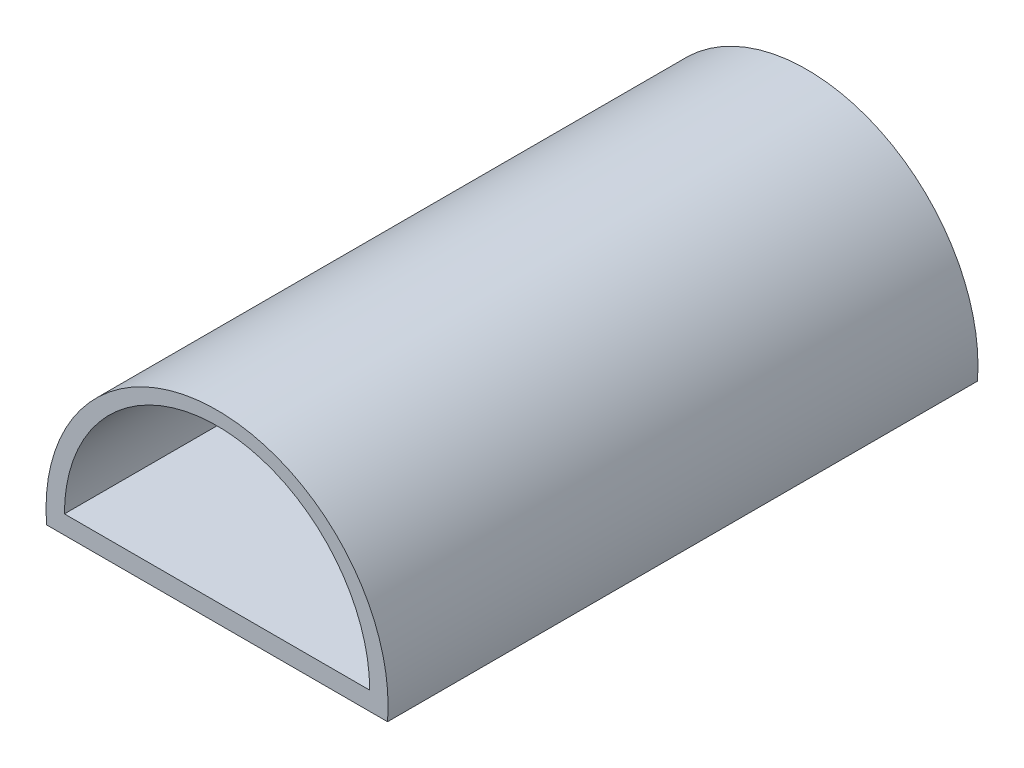
from build123d import *

# Parameters (mm, degrees)
BOSS_EXTRUDE2_DEPTH = 50.8


with BuildPart() as part:
    # Sketch1 → Boss-Extrude2 (new body)
    with BuildSketch(Plane.XY):
        with BuildLine():
            Line((-23.111377793, -10.048425127), (6.257372207, -10.048425127))
            ThreePointArc((6.257372207, -10.048425127), (-8.427002793, 5.85418124), (-23.111377793, -10.048425127))
        make_face()
        with BuildLine():
            Line((-8.427002793, -8.460925127), (-21.571502793, -8.460925127))
            ThreePointArc((-21.571502793, -8.460925127), (-8.427002793, 4.683574873), (4.717497207, -8.460925127))
            Line((4.717497207, -8.460925127), (-8.427002793, -8.460925127))
        make_face(mode=Mode.SUBTRACT)
    extrude(amount=BOSS_EXTRUDE2_DEPTH)


solid = part.part
